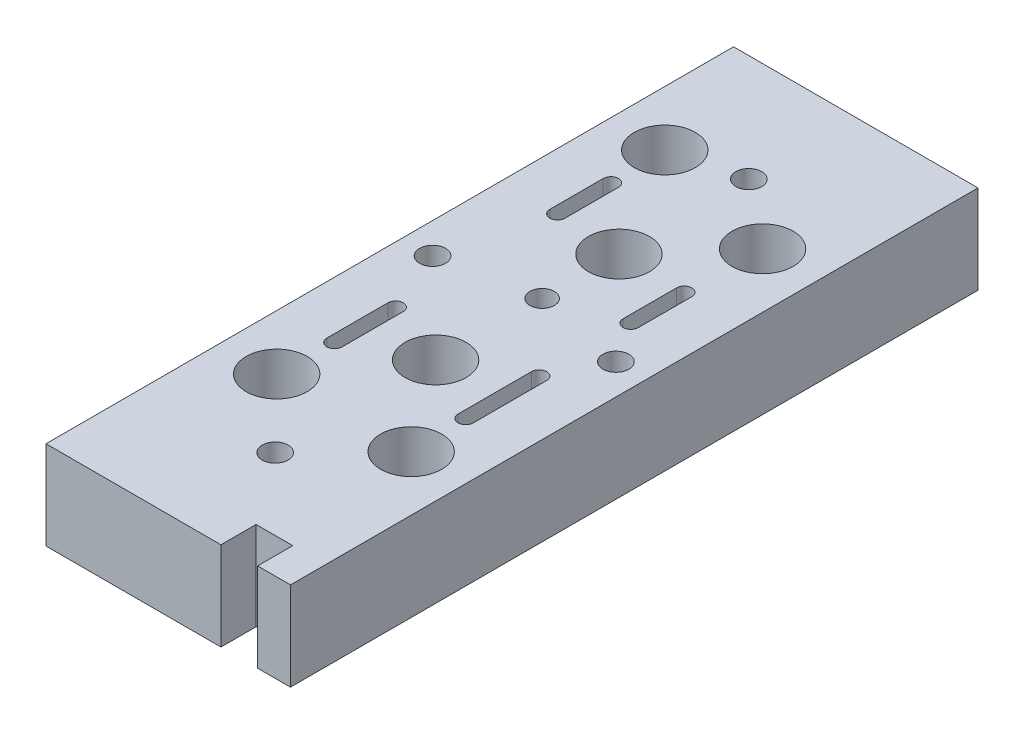
from build123d import *

# Parameters (mm, degrees)
SKETCH1_W           = 80
SKETCH1_H           = 225
BOSS_EXTRUDE1_DEPTH = 29
CUT_EXTRUDE1_REACH  = 124.871
SKETCH4_R           = 10
CUT_EXTRUDE2_DEPTH  = 17
SKETCH5_R           = 8.5
CUT_EXTRUDE3_DEPTH  = 5
CUT_EXTRUDE4_REACH  = 124.871
SKETCH6_W           = 12
SKETCH6_H           = 11.5
M10_TAPPED_HOLE1_D  = 8.5
CUT_EXTRUDE5_REACH  = 124.871
SKETCH10_R          = 4


with BuildPart() as part:
    # Sketch1 → Boss-Extrude1 (new body)
    with BuildSketch(Plane(origin=(0, 0, 0), x_dir=(1, 0, 0), z_dir=(0, 1, 0))):
        Rectangle(SKETCH1_W, SKETCH1_H)
    extrude(amount=-BOSS_EXTRUDE1_DEPTH)

    # Sketch2 → Cut-Extrude1 (cut, up to next)
    with BuildSketch(Plane(origin=(0, 0, 0), x_dir=(1, 0, 0), z_dir=(0, 1, 0)), mode=Mode.PRIVATE) as cut_extrude1_sk1:
        with BuildLine():
            Line((-19, 36.36), (-19, 53.86))
            ThreePointArc((-19, 53.86), (-21.5, 56.36), (-24, 53.86))
            Line((-24, 53.86), (-24, 36.36))
            ThreePointArc((-24, 36.36), (-21.5, 33.86), (-19, 36.36))
        make_face()
    cut_extrude1_tool1 = extrude(cut_extrude1_sk1.sketch, amount=-CUT_EXTRUDE1_REACH, mode=Mode.PRIVATE) & part.part
    # Sketch2 → Cut-Extrude1 (cut, up to next)
    with BuildSketch(Plane(origin=(0, 0, 0), x_dir=(1, 0, 0), z_dir=(0, 1, 0)), mode=Mode.PRIVATE) as cut_extrude1_sk2:
        with BuildLine():
            Line((-19, -36.59), (-19, -16.59))
            ThreePointArc((-19, -16.59), (-21.5, -14.09), (-24, -16.59))
            Line((-24, -16.59), (-24, -36.59))
            ThreePointArc((-24, -36.59), (-21.5, -39.09), (-19, -36.59))
        make_face()
    cut_extrude1_tool2 = extrude(cut_extrude1_sk2.sketch, amount=-CUT_EXTRUDE1_REACH, mode=Mode.PRIVATE) & part.part
    # Sketch2 → Cut-Extrude1 (cut, up to next)
    with BuildSketch(Plane(origin=(0, 0, 0), x_dir=(1, 0, 0), z_dir=(0, 1, 0)), mode=Mode.PRIVATE) as cut_extrude1_sk3:
        with BuildLine():
            Line((24, 17.36), (24, 34.86))
            ThreePointArc((24, 34.86), (21.5, 37.36), (19, 34.86))
            Line((19, 34.86), (19, 17.36))
            ThreePointArc((19, 17.36), (21.5, 14.86), (24, 17.36))
        make_face()
    cut_extrude1_tool3 = extrude(cut_extrude1_sk3.sketch, amount=-CUT_EXTRUDE1_REACH, mode=Mode.PRIVATE) & part.part
    # Sketch2 → Cut-Extrude1 (cut, up to next)
    with BuildSketch(Plane(origin=(0, 0, 0), x_dir=(1, 0, 0), z_dir=(0, 1, 0)), mode=Mode.PRIVATE) as cut_extrude1_sk4:
        with BuildLine():
            Line((24, -36.64), (24, -12.64))
            ThreePointArc((24, -12.64), (21.5, -10.14), (19, -12.64))
            Line((19, -12.64), (19, -36.64))
            ThreePointArc((19, -36.64), (21.5, -39.14), (24, -36.64))
        make_face()
    cut_extrude1_tool4 = extrude(cut_extrude1_sk4.sketch, amount=-CUT_EXTRUDE1_REACH, mode=Mode.PRIVATE) & part.part
    add(cut_extrude1_tool1.solids().sort_by_distance((-21.5, 0, -45.11))[0], mode=Mode.SUBTRACT)
    add(cut_extrude1_tool2.solids().sort_by_distance((-21.5, 0, 26.59))[0], mode=Mode.SUBTRACT)
    add(cut_extrude1_tool3.solids().sort_by_distance((21.5, 0, -26.11))[0], mode=Mode.SUBTRACT)
    add(cut_extrude1_tool4.solids().sort_by_distance((21.5, 0, 24.64))[0], mode=Mode.SUBTRACT)

    # Sketch4 → Cut-Extrude2 (cut)
    with BuildSketch(Plane(origin=(0, 0, 0), x_dir=(1, 0, 0), z_dir=(0, 1, 0))):
        with Locations(Location((-22, 72, 0), (0, 0, 270))):
            Circle(SKETCH4_R)
        with Locations(Location((22, 60, 0), (0, 0, 270))):
            Circle(SKETCH4_R)
        with Locations(Location((0, 35, 0), (0, 0, 270))):
            Circle(SKETCH4_R)
        with Locations(Location((0, -25, 0), (0, 0, 270))):
            Circle(SKETCH4_R)
        with Locations(Location((22, -55, 0), (0, 0, 270))):
            Circle(SKETCH4_R)
        with Locations(Location((-22, -55, 0), (0, 0, 270))):
            Circle(SKETCH4_R)
    extrude(amount=-CUT_EXTRUDE2_DEPTH, mode=Mode.SUBTRACT)

    # Sketch5 → Cut-Extrude3 (cut)
    with BuildSketch(Plane.XZ.offset(29)):
        with Locations(Location((0, 100, 0), (0, 0, 270))):
            Circle(SKETCH5_R)
        with Locations(Location((0, -100, 0), (0, 0, 270))):
            Circle(SKETCH5_R)
    extrude(amount=-CUT_EXTRUDE3_DEPTH, mode=Mode.SUBTRACT)

    # Sketch6 → Cut-Extrude4 (cut, up to next)
    with BuildSketch(Plane(origin=(0, 0, 0), x_dir=(1, 0, 0), z_dir=(0, 1, 0)), mode=Mode.PRIVATE) as cut_extrude4_sk1:
        with Locations((23.25, -106.75)):
            Rectangle(SKETCH6_W, SKETCH6_H)
    cut_extrude4_tool1 = extrude(cut_extrude4_sk1.sketch, amount=-CUT_EXTRUDE4_REACH, mode=Mode.PRIVATE) & part.part
    add(cut_extrude4_tool1.solids().sort_by_distance((23.25, 0, 106.75))[0], mode=Mode.SUBTRACT)

    # M10 Tapped Hole1 (through all)
    with Locations(Plane(origin=(0, 0, 0), x_dir=(1, 0, 0), z_dir=(0, 1, 0))):
        with Locations((0, -77.5), (30, 4), (-30, 4), (0, 77.5)):
            Hole(M10_TAPPED_HOLE1_D / 2)

    # Sketch10 → Cut-Extrude5 (cut, up to next)
    with BuildSketch(Plane(origin=(0, 0, 0), x_dir=(1, 0, 0), z_dir=(0, 1, 0)), mode=Mode.PRIVATE) as cut_extrude5_sk1:
        with Locations(Location((0, 9.86, 0), (0, 0, 270))):
            Circle(SKETCH10_R)
    cut_extrude5_tool1 = extrude(cut_extrude5_sk1.sketch, amount=-CUT_EXTRUDE5_REACH, mode=Mode.PRIVATE) & part.part
    add(cut_extrude5_tool1.solids().sort_by_distance((0, 0, -9.86))[0], mode=Mode.SUBTRACT)


solid = part.part
